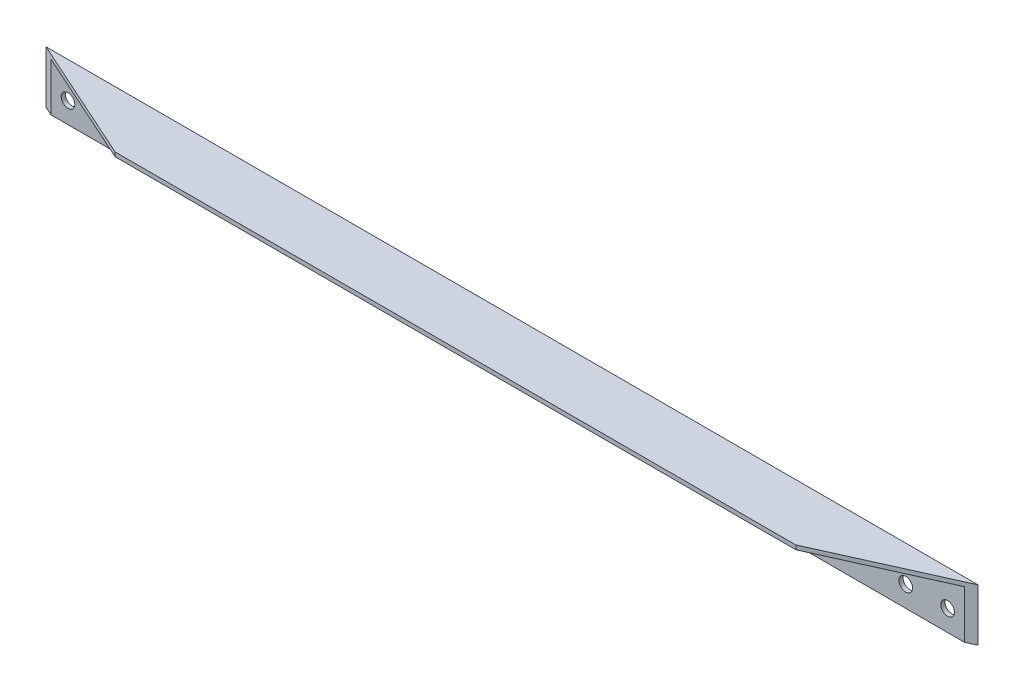
from build123d import *

# Parameters (mm, degrees)
SKETCH_1_W          = 1780
SKETCH_1_H          = 100
SKETCH_1_R          = 13
EXTRUDE_573_DEPTH   = 8
SKETCH_2_W          = 1780
SKETCH_2_H          = 8
EXTRUDE_1_DEPTH     = 100
CUT_EXTRUDE_1_DEPTH = 903.088687436


with BuildPart() as part:
    # 草图1 → Extrude 573 (new body)
    with BuildSketch(Plane.XY):
        with Locations((0, 50)):
            Rectangle(SKETCH_1_W, SKETCH_1_H)
        with Locations((840, 40)):
            Circle(SKETCH_1_R, mode=Mode.SUBTRACT)
        with Locations((760, 40)):
            Circle(SKETCH_1_R, mode=Mode.SUBTRACT)
        with Locations(Location((-840, 40, 0), (0, 0, 180))):
            Circle(SKETCH_1_R, mode=Mode.SUBTRACT)
        with Locations(Location((-760, 40, 0), (0, 0, 180))):
            Circle(SKETCH_1_R, mode=Mode.SUBTRACT)
    extrude(amount=EXTRUDE_573_DEPTH)

    # 草图2 → 凸台-拉伸1 (add)
    with BuildSketch(Plane.XY.offset(8)):
        with Locations((0, 96)):
            Rectangle(SKETCH_2_W, SKETCH_2_H)
    extrude(amount=EXTRUDE_1_DEPTH)

    # 草图3 → 切除-拉伸1 (cut, through all)
    with BuildSketch(Plane(origin=(0, 100, 0), x_dir=(-1, 0, 0), z_dir=(0, 1, 0))):
        Polygon((-650, 108), (-890, 0), (-890, 108), align=None)
        Polygon((890, 108), (650, 108), (890, 0), align=None)
    extrude(amount=-CUT_EXTRUDE_1_DEPTH, mode=Mode.SUBTRACT)


solid = part.part
